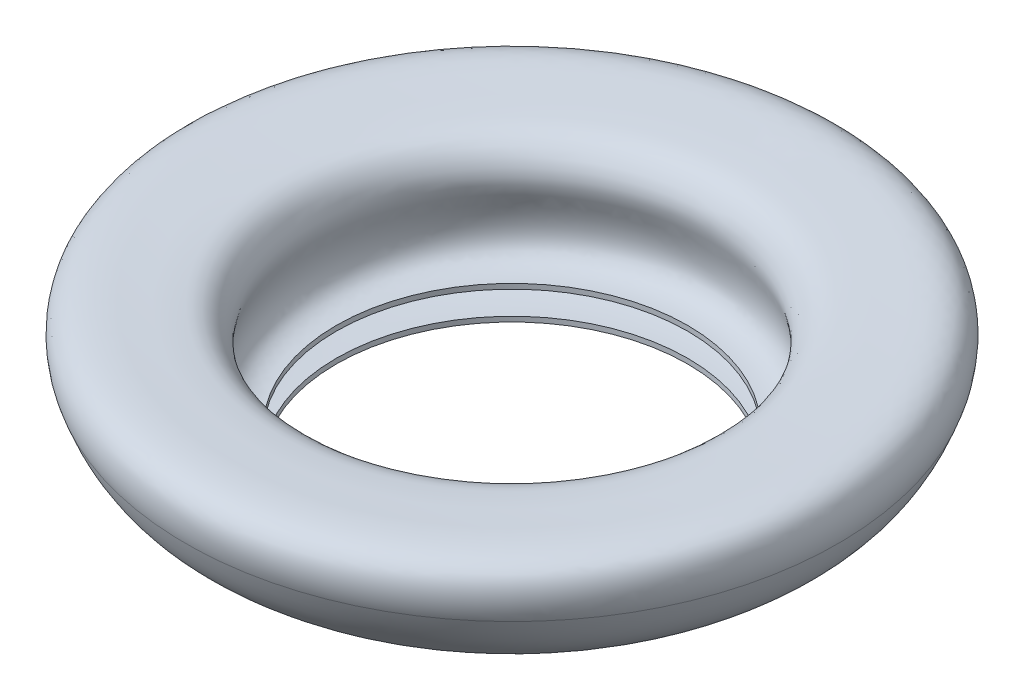
from build123d import *


with BuildPart() as part:
    # Sketch1 → Revolve1 (revolve)
    with BuildSketch(Plane.XY, mode=Mode.PRIVATE) as revolve1_sk:
        with BuildLine():
            Line((-21, -4.5), (-21, -5.1))
            add(Edge.make_bspline(
                [(-21, -5.1), (-21.27327309, -5.1), (-21.840459318, -5.071586268), (-22.800987041, -4.903894124), (-23.812858795, -4.486596363), (-24.669762955, -3.670500073), (-25.305732525, -2.314952192), (-25.349437655, -0.429410503), (-24.765352392, 1.84963414), (-24.192663684, 3.429010942), (-24.147760503, 4.512519123), (-24.373856034, 5.377908195), (-24.827180272, 6.215776653), (-25.635945323, 7.124084625), (-26.821016469, 7.646841852), (-28.474996377, 7.758380815), (-29.993818574, 7.788631541), (-31.600178696, 7.8868342), (-33.60459085, 8.067802744), (-35.807452445, 8.115799699), (-37.510065621, 7.741382086), (-38.463112348, 6.935761649), (-38.834705224, 5.540424024), (-38.738791176, 4.194405104), (-38.542484324, 3.461096209), (-38.415681732, 3.116994042)],
                knots=[0, 0, 0, 0, 0.015625, 0.03125, 0.0625, 0.09375, 0.125, 0.1875, 0.25, 0.3125, 0.34375, 0.375, 0.40625, 0.4375, 0.5, 0.5625, 0.59375, 0.625, 0.6875, 0.75, 0.8125, 0.875, 0.9375, 0.96875, 1, 1, 1, 1], degree=3))
            add(Edge.make_bspline(
                [(-38.415681732, 3.116994042), (-38.261610197, 2.698892583), (-37.941054821, 1.87927755), (-37.354564926, 0.619176977), (-36.662696374, -0.572130657), (-35.585831493, -1.979549639), (-33.886794694, -3.402686611), (-31.460604378, -4.758256349), (-28.870373086, -5.947699616), (-26.323768046, -6.988499704), (-24.159530177, -7.589956014), (-22.383109604, -7.852616903), (-21.458576263, -7.9), (-21, -7.9)],
                knots=[0, 0, 0, 0, 0.0625, 0.125, 0.1875, 0.25, 0.375, 0.5, 0.625, 0.75, 0.875, 0.9375, 1, 1, 1, 1], degree=3))
            Line((-21, -7.9), (-21, -8.5))
            add(Edge.make_bspline(
                [(-21, -8.5), (-24.299121393, -8.5), (-29.585707762, -6.426676931), (-36.532893353, -2.862296284), (-38.417351725, 1.386282628), (-38.978672681, 2.909530333)],
                knots=[0, 0, 0, 0, 0.424599863, 0.770379785, 1, 1, 1, 1], degree=3))
            add(Edge.make_bspline(
                [(-21, -4.5), (-25.166676349, -4.5), (-24.999881565, -0.022890827), (-23.039745829, 4.484727471), (-25.348058045, 8.523720002), (-31.206592105, 8.10462668), (-39.207719476, 9.72223212), (-39.612528658, 4.629615161), (-38.978672681, 2.909530333)],
                knots=[0, 0, 0, 0, 0.242242525, 0.340661928, 0.444265623, 0.598217424, 0.862644115, 1, 1, 1, 1], degree=3))
        make_face()
    revolve(revolve1_sk.sketch.rotate(Axis((0, -24.089855655, 0), (0, 1, 0)), 270), axis=Axis((0, -24.089855655, 0), (0, 1, 0)))


solid = part.part
